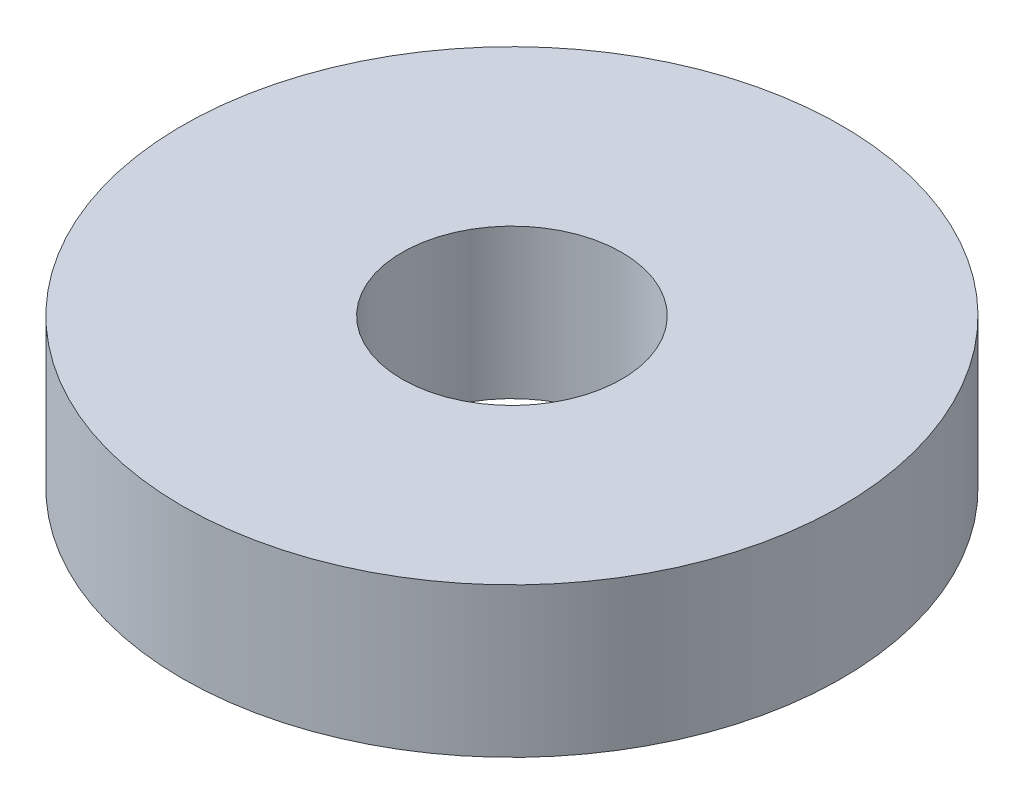
from build123d import *

# Parameters (mm, degrees)
SKETCH_1_R      = 7.5
SKETCH_1_R_2    = 2.5
EXTRUDE_1_DEPTH = 3.4


with BuildPart() as part:
    # 草图1 → 凸台-拉伸1 (new body)
    with BuildSketch(Plane(origin=(0, 0, 0), x_dir=(1, 0, 0), z_dir=(0, 1, 0))):
        with Locations(Location((0, 0, 0), (0, 0, 270))):
            Circle(SKETCH_1_R)
        with Locations(Location((0, 0, 0), (0, 0, 270))):
            Circle(SKETCH_1_R_2, mode=Mode.SUBTRACT)
    extrude(amount=EXTRUDE_1_DEPTH)


solid = part.part
